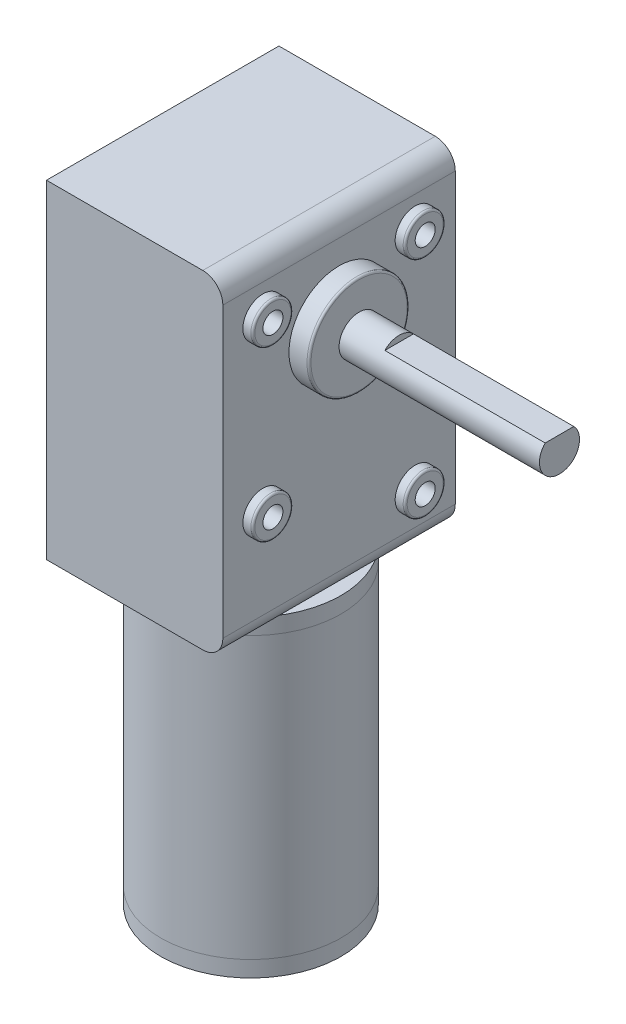
from build123d import *

# Parameters (mm, degrees)
SKETCH1_R                = 22.5
BOSS_EXTRUDE1_DEPTH      = 4
SKETCH2_R                = 22.5
BOSS_EXTRUDE2_DEPTH      = 70
SKETCH3_R                = 22.5
BOSS_EXTRUDE3_DEPTH      = 4
SKETCH4_W                = 44
SKETCH4_H                = 58
BOSS_EXTRUDE4_DEPTH      = 82
SKETCH5_W                = 3
SKETCH5_H                = 58
CUT_EXTRUDE1_DEPTH       = 82
SKETCH6_W                = 3
SKETCH6_H                = 58
BOSS_EXTRUDE5_DEPTH      = 82
BOSS_EXTRUDE6_DEPTH      = 5
BOSS_EXTRUDE6_DEPTH_BACK = 49
SKETCH7_R                = 12.5
SKETCH8_R                = 5
BOSS_EXTRUDE7_DEPTH      = 50
CUT_EXTRUDE2_DEPTH       = 40
BOSS_EXTRUDE8_DEPTH      = 2.5
BOSS_EXTRUDE8_DEPTH_BACK = 46.5
SKETCH10_R               = 5
SKETCH11_R               = 2.5
CUT_EXTRUDE3_DEPTH       = 8
FILLET1_R                = 5
FILLET2_R                = 0.5


with BuildPart() as part:
    # Sketch1 → Boss-Extrude1 (new body)
    with BuildSketch(Plane(origin=(0, 0, 0), x_dir=(1, 0, 0), z_dir=(0, 1, 0))):
        with Locations(Location((0, 0, 0), (0, 0, 270))):
            Circle(SKETCH1_R)
    extrude(amount=BOSS_EXTRUDE1_DEPTH)


with BuildPart() as body_2:
    # Sketch2 → Boss-Extrude2 (new body)
    with BuildSketch(Plane(origin=(0, 4, 0), x_dir=(1, 0, 0), z_dir=(0, 1, 0))):
        with Locations(Location((0, 0, 0), (0, 0, 270))):
            Circle(SKETCH2_R)
    extrude(amount=BOSS_EXTRUDE2_DEPTH)


with BuildPart() as body_3:
    # Sketch3 → Boss-Extrude3 (new body)
    with BuildSketch(Plane(origin=(0, 74, 0), x_dir=(1, 0, 0), z_dir=(0, 1, 0))):
        with Locations(Location((0, 0, 0), (0, 0, 270))):
            Circle(SKETCH3_R)
    extrude(amount=BOSS_EXTRUDE3_DEPTH)


with BuildPart() as body_4:
    # Sketch4 → Boss-Extrude4 (new body)
    with BuildSketch(Plane(origin=(0, 78, 0), x_dir=(1, 0, 0), z_dir=(0, 1, 0))):
        Rectangle(SKETCH4_W, SKETCH4_H)
    extrude(amount=BOSS_EXTRUDE4_DEPTH)

    # Sketch5 → Cut-Extrude1 (cut)
    with BuildSketch(Plane(origin=(0, 160, 0), x_dir=(1, 0, 0), z_dir=(0, 1, 0))):
        with Locations((-20.5, 0)):
            Rectangle(SKETCH5_W, SKETCH5_H)
    extrude(amount=-CUT_EXTRUDE1_DEPTH, mode=Mode.SUBTRACT)

    # Sketch7 → Boss-Extrude6 (add, two sides: drawn at the far end of the back side and taken through both)
    with BuildSketch(Plane(origin=(22, 0, 0), x_dir=(0, 0, -1), z_dir=(1, 0, 0)).offset(-BOSS_EXTRUDE6_DEPTH_BACK)):
        with Locations((0, 136.5)):
            Circle(SKETCH7_R)
    extrude(amount=BOSS_EXTRUDE6_DEPTH + BOSS_EXTRUDE6_DEPTH_BACK)

    # Sketch8 → Boss-Extrude7 (add)
    with BuildSketch(Plane(origin=(27, 0, 0), x_dir=(0, 0, -1), z_dir=(1, 0, 0))):
        with Locations((0, 136.5)):
            Circle(SKETCH8_R)
    extrude(amount=BOSS_EXTRUDE7_DEPTH)

    # Sketch9 → Cut-Extrude2 (cut)
    with BuildSketch(Plane(origin=(77, 0, 0), x_dir=(0, 0, -1), z_dir=(1, 0, 0))):
        with BuildLine():
            Line((-3.570714214, 140), (3.570714214, 140))
            ThreePointArc((3.570714214, 140), (0, 141.5), (-3.570714214, 140))
        make_face()
    extrude(amount=-CUT_EXTRUDE2_DEPTH, mode=Mode.SUBTRACT)



with BuildPart() as body_5:
    # Sketch6 → Boss-Extrude5 (new body)
    with BuildSketch(Plane(origin=(0, 160, 0), x_dir=(1, 0, 0), z_dir=(0, 1, 0))):
        with Locations((-20.5, 0)):
            Rectangle(SKETCH6_W, SKETCH6_H)
    extrude(amount=-BOSS_EXTRUDE5_DEPTH)


with BuildPart() as body_4_1:
    add(body_4.part)

    add(body_5.part)  # Boss-Extrude8 merges body 5
    # Sketch10 → Boss-Extrude8 (add, two sides: drawn at the far end of the back side and taken through both)
    with BuildSketch(Plane(origin=(22, 0, 0), x_dir=(0, 0, -1), z_dir=(1, 0, 0)).offset(-BOSS_EXTRUDE8_DEPTH_BACK)):
        with Locations((-19, 147.438925726)):
            Circle(SKETCH10_R)
        with Locations((-19, 105.438925726)):
            Circle(SKETCH10_R)
        with Locations((19, 147.438925726)):
            Circle(SKETCH10_R)
        with Locations((19, 91.43)):
            Circle(SKETCH10_R)
    extrude(amount=BOSS_EXTRUDE8_DEPTH + BOSS_EXTRUDE8_DEPTH_BACK)

    # Sketch11 → Cut-Extrude3 (cut)
    with BuildSketch(Plane(origin=(24.5, 0, 0), x_dir=(0, 0, -1), z_dir=(1, 0, 0))):
        with Locations((-19, 147.438925726)):
            Circle(SKETCH11_R)
        with Locations((19, 147.438925726)):
            Circle(SKETCH11_R)
        with Locations((19, 91.43)):
            Circle(SKETCH11_R)
        with Locations((-19, 105.438925726)):
            Circle(SKETCH11_R)
    extrude(amount=-CUT_EXTRUDE3_DEPTH, mode=Mode.SUBTRACT)

    # Fillet1
    fillet1_edges = [body_4_1.edges().sort_by_distance(p)[0] for p in [
        (22, 78, 0),
        (22, 160, 0),
    ]]
    fillet(fillet1_edges, radius=FILLET1_R)

    # Fillet2
    fillet2_edges = [body_4_1.edges().sort_by_distance(p)[0] for p in [
        (-24.5, 147.438925726, 24),
        (24.5, 147.438925726, 24),
        (-27, 136.5, 12.5),
        (27, 136.5, 12.5),
        (-24.5, 105.438925726, 24),
        (24.5, 105.438925726, 24),
        (-24.5, 147.438925726, -14),
        (24.5, 147.438925726, -14),
        (-24.5, 91.43, -14),
        (24.5, 91.43, -14),
    ]]
    fillet(fillet2_edges, radius=FILLET2_R)


solid = Compound([part.part, body_2.part, body_3.part, body_4_1.part])
